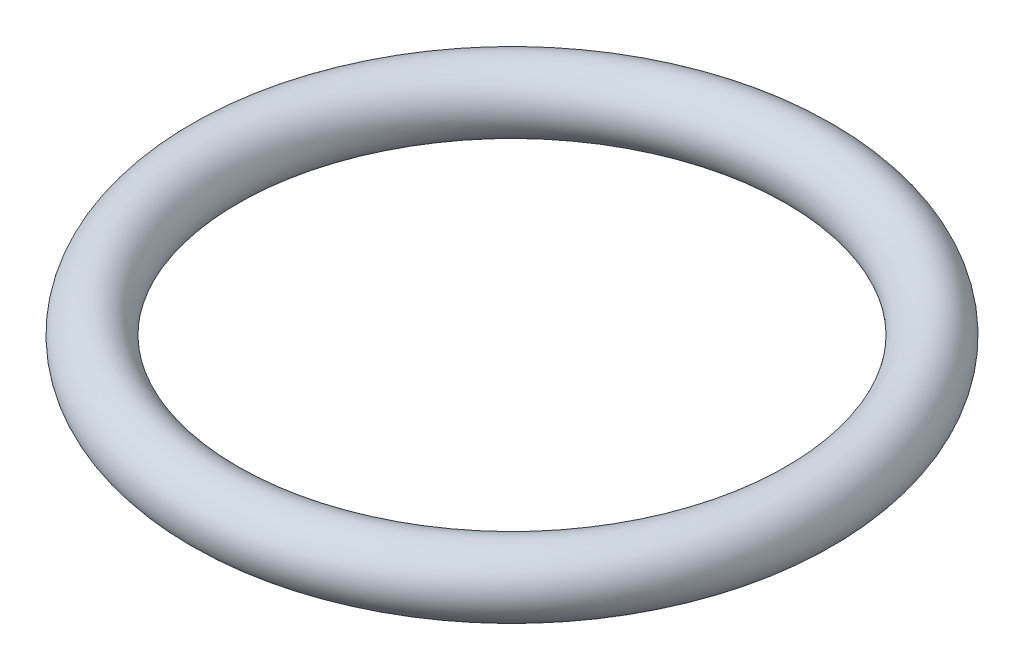
from build123d import *

# Parameters (mm, degrees)
SWEEP1_PROFILE_R = 1.55


with BuildPart() as part:
    # Sweep1: sweep along a path in Sketch1
    with BuildLine(Plane(origin=(0, 0, 0), x_dir=(1, 0, 0), z_dir=(0, 1, 0))) as sweep1_path:
        CenterArc((0, 0), 14.15, 0, 360)
    # Sweep1 profile (on start of the path) → Sweep1 (sweep)
    with BuildSketch(Plane(origin=(14.15, 0, 0), x_dir=(-1, 0, 0), z_dir=(0, 0, -1))):
        Circle(SWEEP1_PROFILE_R)
    sweep(path=sweep1_path.line)


solid = part.part
